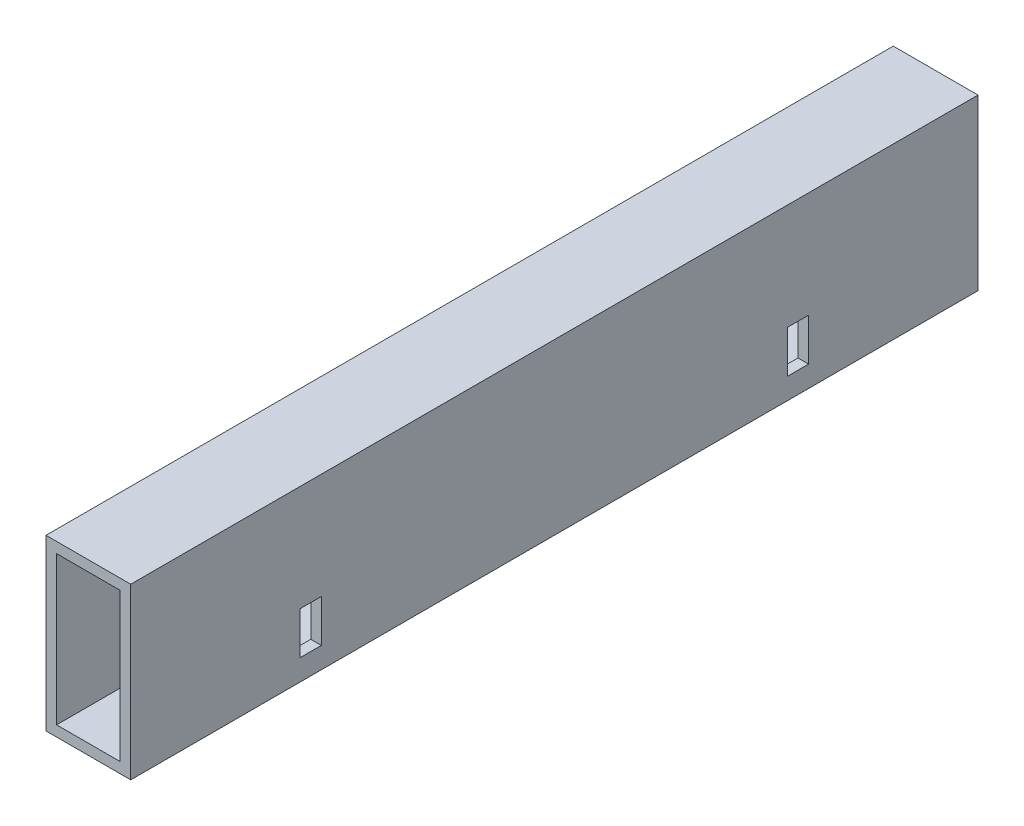
from build123d import *

# Parameters (mm, degrees)
SKETCH1_W           = 25.4
SKETCH1_H           = 50.8
SKETCH1_W_2         = 19.05
SKETCH1_H_2         = 44.45
BOSS_EXTRUDE1_DEPTH = 254
SKETCH2_R           = 6.482173328
CUT_EXTRUDE1_DEPTH  = 254
BOSS_EXTRUDE2_START = -25.4
SKETCH3_R           = 6.482173328
BOSS_EXTRUDE2_DEPTH = 25.4
SKETCH4_W           = 19.05
SKETCH4_H           = 44.45
CUT_EXTRUDE2_DEPTH  = 254
CUT_EXTRUDE3_DEPTH  = 254


with BuildPart() as part:
    # Sketch1 → Boss-Extrude1 (new body)
    with BuildSketch(Plane.XY):
        with Locations((12.7, 25.4)):
            Rectangle(SKETCH1_W, SKETCH1_H)
        with Locations((12.7, 25.4)):
            Rectangle(SKETCH1_W_2, SKETCH1_H_2, mode=Mode.SUBTRACT)
    extrude(amount=BOSS_EXTRUDE1_DEPTH)

    # Sketch2 → Cut-Extrude1 (cut)
    with BuildSketch(Plane(origin=(25.4, 0, 0), x_dir=(0, 0, -1), z_dir=(1, 0, 0))):
        with Locations((-209.55, 12.7)):
            Circle(SKETCH2_R)
        with Locations((-44.45, 12.7)):
            Circle(SKETCH2_R)
    extrude(amount=-CUT_EXTRUDE1_DEPTH, mode=Mode.SUBTRACT)

    # Sketch3 → Boss-Extrude2 (add)
    with BuildSketch(Plane.ZY.offset(BOSS_EXTRUDE2_START)):
        with Locations((209.55, 12.7)):
            Circle(SKETCH3_R)
        with Locations((44.45, 12.7)):
            Circle(SKETCH3_R)
    extrude(amount=BOSS_EXTRUDE2_DEPTH)

    # Sketch4 → Cut-Extrude2 (cut)
    with BuildSketch(Plane.XY.offset(254)):
        with Locations((12.7, 25.4)):
            Rectangle(SKETCH4_W, SKETCH4_H)
    extrude(amount=-CUT_EXTRUDE2_DEPTH, mode=Mode.SUBTRACT)

    # Sketch5 → Cut-Extrude3 (cut)
    with BuildSketch(Plane.ZY):
        Polygon((196.85, 19.05), (196.85, 6.326748406), (203.2, 6.35), (203.2, 19.05), align=None)
        Polygon((57.15, 6.326748406), (50.8, 6.35), (50.8, 19.05), (57.15, 19.05), align=None)
    extrude(amount=-CUT_EXTRUDE3_DEPTH, mode=Mode.SUBTRACT)


solid = part.part
